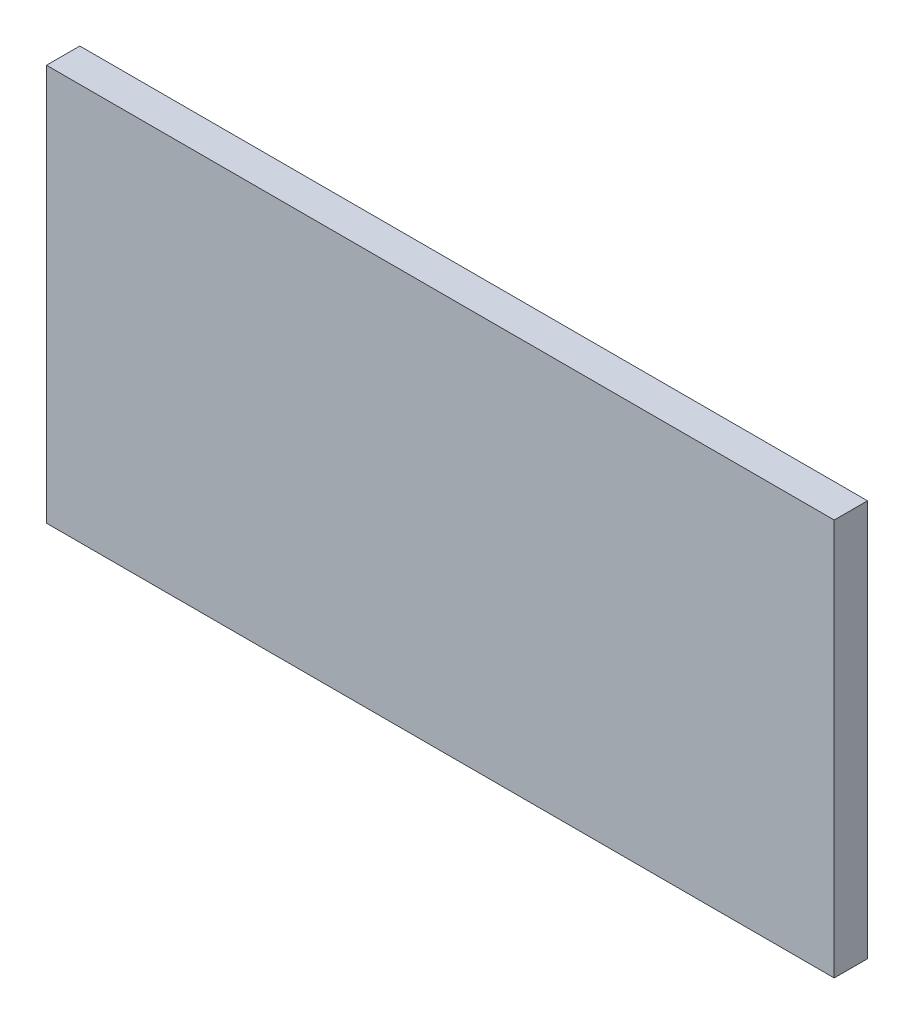
from build123d import *

# Parameters (mm, degrees)
ESQUISSE1_W        = 142
ESQUISSE1_H        = 71.5
BOSS_EXTRU_1_DEPTH = 6


with BuildPart() as part:
    # Esquisse1 → Boss.-Extru.1 (new body)
    with BuildSketch(Plane.XY):
        with Locations((-71, 35.75)):
            Rectangle(ESQUISSE1_W, ESQUISSE1_H)
    extrude(amount=BOSS_EXTRU_1_DEPTH)


solid = part.part
